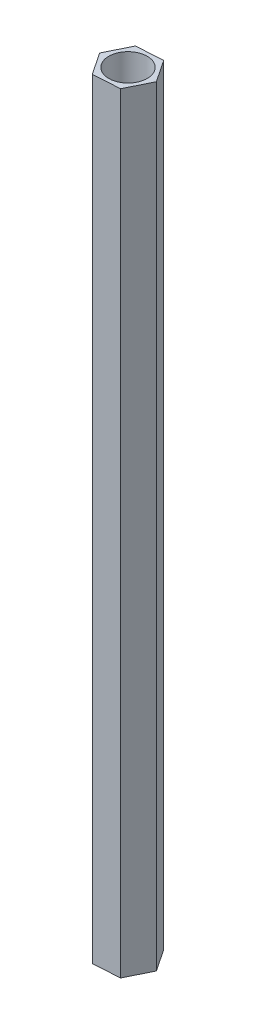
from build123d import *

# Parameters (mm, degrees)
SKETCH_1_R      = 1.25
EXTRUDE_1_DEPTH = 50


with BuildPart() as part:
    # 草图1 → 凸台-拉伸1 (new body)
    with BuildSketch(Plane(origin=(0, 0, 0), x_dir=(1, 0, 0), z_dir=(0, 1, 0))):
        Polygon((0.960768923, -1.441153384), (1.728459903, 0.111473602), (0.76769098, 1.552626986), (-0.960768923, 1.441153384), (-1.728459903, -0.111473602), (-0.76769098, -1.552626986), align=None)
        with Locations(Location((0, 0, 0), (0, 0, 270))):
            Circle(SKETCH_1_R, mode=Mode.SUBTRACT)
    extrude(amount=EXTRUDE_1_DEPTH)


solid = part.part
